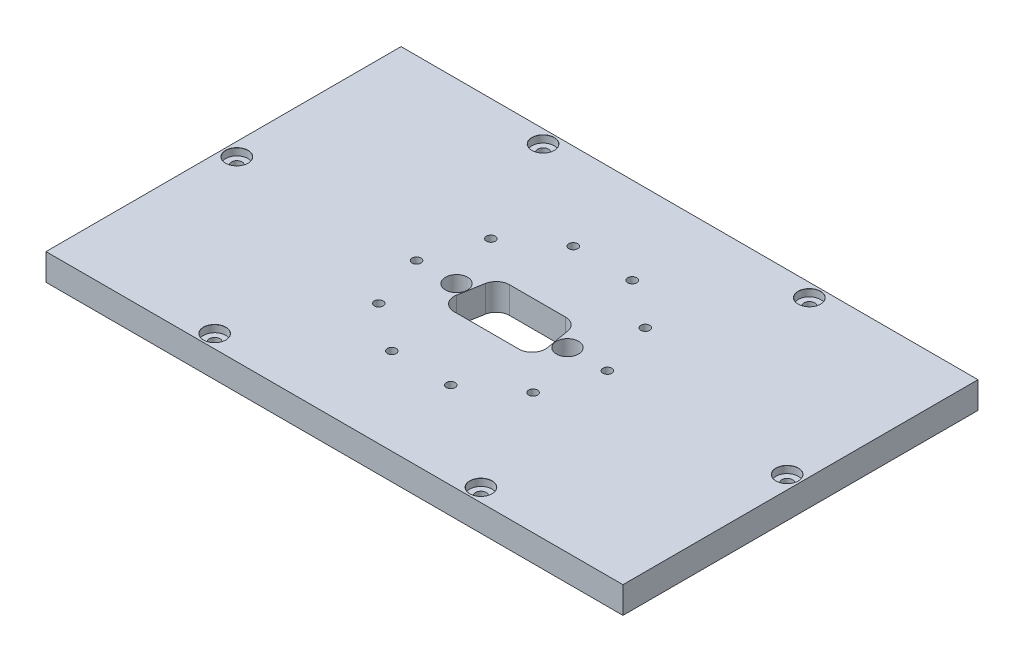
from build123d import *

# Parameters (mm, degrees)
SKIZZE1_W                                    = 130
SKIZZE1_H                                    = 80
AUFSATZ_LINEAR_AUSTRAGEN1_DEPTH              = 6
F_2_4_2_4_DURCHMESSER_BOHRUNG1_D             = 2.4
F_2_4_2_4_DURCHMESSER_BOHRUNG1_DEPTH         = 10
F_2_4_2_4_DURCHMESSER_BOHRUNG1_CSINK_D       = 2.45
F_2_4_2_4_DURCHMESSER_BOHRUNG1_CSINK_ANGLE   = 90
F_2_4_2_4_DURCHMESSER_BOHRUNG1_TIP           = 0.721032743
STIRNSENKUNG_F_R_M2_FLACHKOPFSCHRAUB_2_COUNT = 2
STIRNSENKUNG_F_R_M2_FLACHKOPFSCHRAUB_2_PITCH = 48.918299235
STIRNSENKUNG_F_R_M2_FLACHKOPFSCHRAUB_3_COUNT = 2
STIRNSENKUNG_F_R_M2_FLACHKOPFSCHRAUB_3_PITCH = 74
STIRNSENKUNG_F_R_M2_FLACHKOPFSCHRAUB_4_COUNT = 2
STIRNSENKUNG_F_R_M2_FLACHKOPFSCHRAUB_4_PITCH = 95.268042911
STIRNSENKUNG_F_R_M2_FLACHKOPFSCHRAUB_5_COUNT = 2
STIRNSENKUNG_F_R_M2_FLACHKOPFSCHRAUB_5_PITCH = 99.161484458
STIRNSENKUNG_F_R_M2_FLACHKOPFSCHRAUB_6_COUNT = 2
STIRNSENKUNG_F_R_M2_FLACHKOPFSCHRAUB_6_PITCH = 60
SKIZZE8_R                                    = 1
SKIZZE8_R_2                                  = 2.5
SCHNITT_LINEAR_AUSTRAGEN1_DEPTH              = 6


with BuildPart() as part:
    # Skizze1 → Aufsatz-Linear austragen1 (new body)
    with BuildSketch(Plane(origin=(0, 0, 0), x_dir=(1, 0, 0), z_dir=(0, 1, 0))):
        with Locations((65, 40)):
            Rectangle(SKIZZE1_W, SKIZZE1_H)
    extrude(amount=AUFSATZ_LINEAR_AUSTRAGEN1_DEPTH)

    # Ø2.4 (2.4) Durchmesser Bohrung1
    with Locations(Plane(origin=(0, 6, 0), x_dir=(1, 0, 0), z_dir=(0, 1, 0))):
        with Locations((35, 77), (95, 77), (127, 40), (95, 3), (35, 3), (3, 40), (133.088689194, 32.803420387)):
            CounterSinkHole(F_2_4_2_4_DURCHMESSER_BOHRUNG1_D / 2, F_2_4_2_4_DURCHMESSER_BOHRUNG1_CSINK_D / 2, depth=F_2_4_2_4_DURCHMESSER_BOHRUNG1_DEPTH, counter_sink_angle=F_2_4_2_4_DURCHMESSER_BOHRUNG1_CSINK_ANGLE)
            with Locations((0, 0, -(F_2_4_2_4_DURCHMESSER_BOHRUNG1_DEPTH + F_2_4_2_4_DURCHMESSER_BOHRUNG1_TIP / 2))):  # 118° drill point
                Cone(0, F_2_4_2_4_DURCHMESSER_BOHRUNG1_D / 2, F_2_4_2_4_DURCHMESSER_BOHRUNG1_TIP, mode=Mode.SUBTRACT)

    # Skizze7 → Stirnsenkung für M2 Flachkopfschraube mit Schlitz1 (revolve, cut)
    with BuildSketch(Plane(origin=(95, 6, -3), x_dir=(0, 0, 1), z_dir=(1, 0, 0))):
        Polygon((0, 0), (0, 2.721032743), (1.2, 2), (1.2, 1.6), (2.5, 1.6), (2.5, 0.025), (2.525, 0), align=None)
    stirnsenkung_f_r_m2_flachkopfschraube_mi = revolve(axis=Axis((95, 12.35, -3), (0, -1, 0)), mode=Mode.SUBTRACT)

    # Stirnsenkung f_r M2 Flachkopfschraub 2: Stirnsenkung für M2 Flachkopfschraube mit Schlitz1 ×2
    with Locations(*[Vector(0.6541519329315842, 0, -0.7563631724521444) * (i * STIRNSENKUNG_F_R_M2_FLACHKOPFSCHRAUB_2_PITCH) for i in range(1, STIRNSENKUNG_F_R_M2_FLACHKOPFSCHRAUB_2_COUNT)]):
        add(stirnsenkung_f_r_m2_flachkopfschraube_mi, mode=Mode.SUBTRACT)

    # Stirnsenkung f_r M2 Flachkopfschraub 3: Stirnsenkung für M2 Flachkopfschraube mit Schlitz1 ×2
    with Locations(*[(0, 0, -i * STIRNSENKUNG_F_R_M2_FLACHKOPFSCHRAUB_3_PITCH) for i in range(1, STIRNSENKUNG_F_R_M2_FLACHKOPFSCHRAUB_3_COUNT)]):
        add(stirnsenkung_f_r_m2_flachkopfschraube_mi, mode=Mode.SUBTRACT)

    # Stirnsenkung f_r M2 Flachkopfschraub 4: Stirnsenkung für M2 Flachkopfschraube mit Schlitz1 ×2
    with Locations(*[Vector(-0.6298019584212194, 0, -0.7767557487195037) * (i * STIRNSENKUNG_F_R_M2_FLACHKOPFSCHRAUB_4_PITCH) for i in range(1, STIRNSENKUNG_F_R_M2_FLACHKOPFSCHRAUB_4_COUNT)]):
        add(stirnsenkung_f_r_m2_flachkopfschraube_mi, mode=Mode.SUBTRACT)

    # Stirnsenkung f_r M2 Flachkopfschraub 5: Stirnsenkung für M2 Flachkopfschraube mit Schlitz1 ×2
    with Locations(*[Vector(-0.9277795759357077, 0, -0.37312874249588235) * (i * STIRNSENKUNG_F_R_M2_FLACHKOPFSCHRAUB_5_PITCH) for i in range(1, STIRNSENKUNG_F_R_M2_FLACHKOPFSCHRAUB_5_COUNT)]):
        add(stirnsenkung_f_r_m2_flachkopfschraube_mi, mode=Mode.SUBTRACT)

    # Stirnsenkung f_r M2 Flachkopfschraub 6: Stirnsenkung für M2 Flachkopfschraube mit Schlitz1 ×2
    with Locations(*[(-i * STIRNSENKUNG_F_R_M2_FLACHKOPFSCHRAUB_6_PITCH, 0, 0) for i in range(1, STIRNSENKUNG_F_R_M2_FLACHKOPFSCHRAUB_6_COUNT)]):
        add(stirnsenkung_f_r_m2_flachkopfschraube_mi, mode=Mode.SUBTRACT)

    # Skizze8 → Schnitt-Linear austragen1 (cut)
    with BuildSketch(Plane(origin=(0, 6, 0), x_dir=(1, 0, 0), z_dir=(0, 1, 0))):
        with Locations(Location((47.606134621, 52.637382924, 0), (0, 0, 270))):
            Circle(SKIZZE8_R)
        with Locations(Location((58.356134621, 60.4477151, 0), (0, 0, 270))):
            Circle(SKIZZE8_R)
        with Locations(Location((71.643865379, 60.4477151, 0), (0, 0, 270))):
            Circle(SKIZZE8_R)
        with Locations(Location((82.393865379, 52.637382924, 0), (0, 0, 270))):
            Circle(SKIZZE8_R)
        with Locations(Location((86.5, 40, 0), (0, 0, 270))):
            Circle(SKIZZE8_R)
        with Locations(Location((82.393865379, 27.362617076, 0), (0, 0, 270))):
            Circle(SKIZZE8_R)
        with Locations(Location((71.643865379, 19.5522849, 0), (0, 0, 270))):
            Circle(SKIZZE8_R)
        with Locations(Location((58.356134621, 19.5522849, 0), (0, 0, 270))):
            Circle(SKIZZE8_R)
        with Locations(Location((47.606134621, 27.362617076, 0), (0, 0, 270))):
            Circle(SKIZZE8_R)
        with Locations(Location((43.5, 40, 0), (0, 0, 270))):
            Circle(SKIZZE8_R)
        with Locations(Location((77.5, 40, 0), (0, 0, 270))):
            Circle(SKIZZE8_R_2)
        with Locations(Location((52.5, 40, 0), (0, 0, 270))):
            Circle(SKIZZE8_R_2)
        with BuildLine():
            Line((72.295576741, 34.25), (57.704423259, 34.25))
            ThreePointArc((57.704423259, 34.25), (55.40628993, 35.321637171), (54.75, 37.770944533))
            Line((54.75, 37.770944533), (55.719798394, 43.270944533))
            ThreePointArc((55.719798394, 43.270944533), (56.745858824, 45.048133329), (58.674221653, 45.75))
            Line((58.674221653, 45.75), (71.325778347, 45.75))
            ThreePointArc((71.325778347, 45.75), (73.254141176, 45.048133329), (74.280201606, 43.270944533))
            Line((74.280201606, 43.270944533), (75.25, 37.770944533))
            ThreePointArc((75.25, 37.770944533), (74.59371007, 35.321637171), (72.295576741, 34.25))
        make_face()
    extrude(amount=-SCHNITT_LINEAR_AUSTRAGEN1_DEPTH, mode=Mode.SUBTRACT)


solid = part.part
